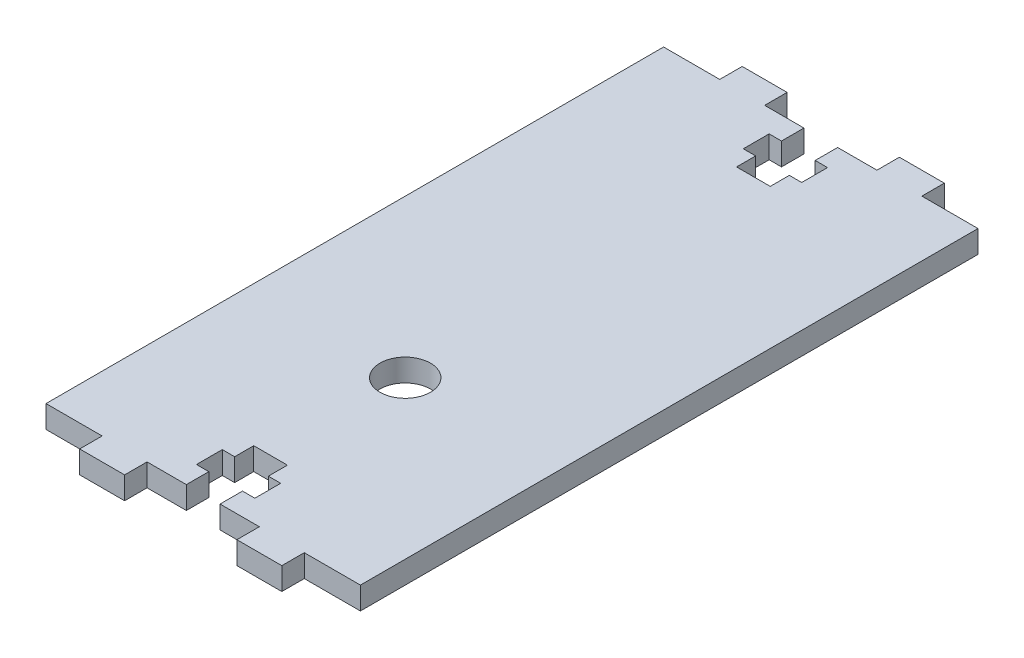
from build123d import *

# Parameters (mm, degrees)
BOSS_EXTRUDE1_DEPTH = 2
CUT_EXTRUDE2_DEPTH  = 2
SKETCH5_R           = 2.25
CUT_EXTRUDE4_DEPTH  = 2


with BuildPart() as part:
    # Sketch1 → Boss-Extrude1 (new body)
    with BuildSketch(Plane(origin=(0, 0, 0), x_dir=(1, 0, 0), z_dir=(0, 1, 0))):
        Polygon((-14, -27.5), (-9, -27.5), (-9, -29.5), (-5, -29.5), (-5, -27.5), (5, -27.5), (5, -29.5), (9, -29.5), (9, -27.5), (14, -27.5), (14, 27.5), (9, 27.5), (9, 29.5), (5, 29.5), (5, 27.5), (-5, 27.5), (-5, 29.5), (-9, 29.5), (-9, 27.5), (-14, 27.5), (-14, 14.5), (-14, -14.5), align=None)
    extrude(amount=BOSS_EXTRUDE1_DEPTH)

    # Sketch4 → Cut-Extrude2 (cut)
    with BuildSketch(Plane(origin=(0, 2, 0), x_dir=(1, 0, 0), z_dir=(0, 1, 0))):
        Polygon((-1.5, 23.2), (-2.6, 23.2), (-2.6, 25.5), (-1.5, 25.5), (-1.5, 27.5), (1.5, 27.5), (1.5, 25.5), (2.6, 25.5), (2.6, 23.2), (1.5, 23.2), (1.5, 21.5), (-1.5, 21.5), align=None)
        Polygon((1.5, -25.5), (1.5, -27.5), (-1.5, -27.5), (-1.5, -25.5), (-2.6, -25.5), (-2.6, -23.2), (-1.5, -23.2), (-1.5, -21.5), (1.5, -21.5), (1.5, -23.2), (2.6, -23.2), (2.6, -25.5), align=None)
    extrude(amount=-CUT_EXTRUDE2_DEPTH, mode=Mode.SUBTRACT)

    # Sketch5 → Cut-Extrude4 (cut)
    with BuildSketch(Plane(origin=(0, 2, 0), x_dir=(1, 0, 0), z_dir=(0, 1, 0))):
        with Locations(Location((0, -9.51, 0), (0, 0, 270))):
            Circle(SKETCH5_R)
    extrude(amount=-CUT_EXTRUDE4_DEPTH, mode=Mode.SUBTRACT)


solid = part.part
